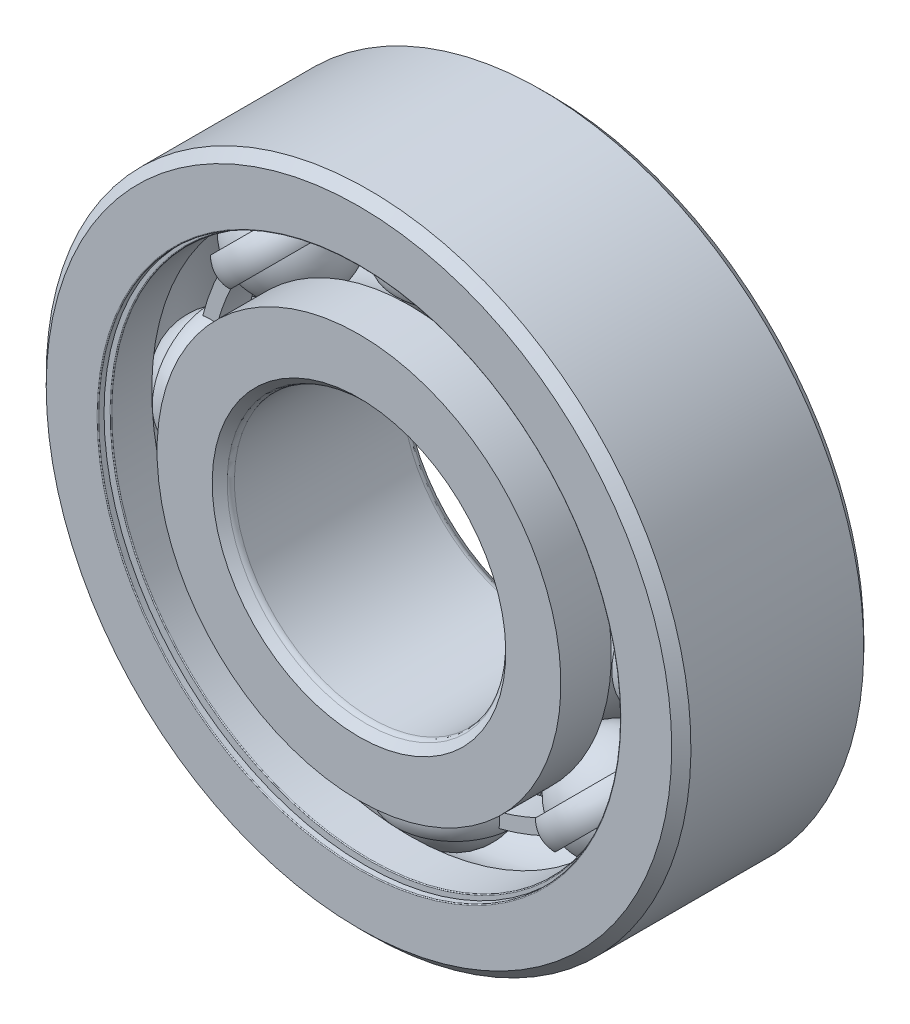
from build123d import *

# Parameters (mm, degrees)
BOSS_EXTRUDE1_DEPTH = 1.166666667
CIRPATTERN1_COUNT   = 8
CIRPATTERN2_COUNT   = 8
FILLET1_R           = 0.063
FILLET2_R           = 0.525


with BuildPart() as part:
    # Sketch3 → Revolve1 (revolve)
    with BuildSketch(Plane(origin=(0, 0, 0), x_dir=(0, 0, -1), z_dir=(1, 0, 0)), mode=Mode.PRIVATE) as revolve1_sk:
        with BuildLine():
            Line((6.3, 23.5), (7, 22.8))
            Line((7, 22.8), (7, 18.780769231))
            Line((7, 18.780769231), (3.325, 18.780769231))
            ThreePointArc((3.325, 18.780769231), (0, 20.646106861), (-3.325, 18.780769231))
            Line((-3.325, 18.780769231), (-7, 18.780769231))
            Line((-7, 18.780769231), (-7, 22.8))
            Line((-7, 22.8), (-6.3, 23.5))
            Line((-6.3, 23.5), (6.3, 23.5))
        make_face()
    revolve(revolve1_sk.sketch.rotate(Axis((0, 0, 7), (0, 0, -1)), 180), axis=Axis((0, 0, 7), (0, 0, -1)))

    # Sketch8 → Cut-Revolve1 (revolve, cut)
    with BuildSketch(Plane(origin=(0, 0, 0), x_dir=(0, 0, -1), z_dir=(1, 0, 0)), mode=Mode.PRIVATE) as cut_revolve1_sk:
        Polygon((-6.552, 18.780769231), (-6.3, 18.780769231), (-6.3, 20.353846154), (-6.552, 20.353846154), (-6.552, 19.032769231), (-7, 19.032769231), (-7, 18.780769231), align=None)
        Polygon((6.3, 18.780769231), (6.552, 18.780769231), (7, 18.780769231), (7, 19.032769231), (6.552, 19.032769231), (6.552, 20.353846154), (6.3, 20.353846154), align=None)
    revolve(cut_revolve1_sk.sketch.rotate(Axis((0, 0, 7), (0, 0, -1)), 180), axis=Axis((0, 0, 7), (0, 0, -1)), mode=Mode.SUBTRACT)

    # Fillet1
    fillet1_edges = [part.edges().sort_by_distance(p)[0] for p in [
        (0, 19.032769231, 7),
        (0, 18.780769231, 6.3),
        (0, 19.032769231, -7),
        (0, 18.780769231, -6.3),
    ]]
    fillet(fillet1_edges, radius=FILLET1_R)


with BuildPart() as body_2:
    # Sketch4 → Revolve2 (revolve)
    with BuildSketch(Plane(origin=(0, 0, 0), x_dir=(0, 0, -1), z_dir=(1, 0, 0)), mode=Mode.PRIVATE) as revolve2_sk:
        with BuildLine():
            Line((-6.3, 10), (-7, 10.7))
            Line((-7, 10.7), (-7, 14.719230769))
            Line((-7, 14.719230769), (-3.325, 14.719230769))
            ThreePointArc((-3.325, 14.719230769), (0, 12.853893139), (3.325, 14.719230769))
            Line((3.325, 14.719230769), (7, 14.719230769))
            Line((7, 14.719230769), (7, 10.7))
            Line((7, 10.7), (6.3, 10))
            Line((6.3, 10), (-6.3, 10))
        make_face()
    revolve(revolve2_sk.sketch.rotate(Axis((0, 0, 7), (0, 0, -1)), 180), axis=Axis((0, 0, 7), (0, 0, -1)))

    # Fillet2
    fillet2_edges = [body_2.edges().sort_by_distance(p)[0] for p in [
        (0, 10, 6.3),
        (0, 10, -6.3),
    ]]
    fillet(fillet2_edges, radius=FILLET2_R)


with BuildPart() as body_3:
    # Sketch5 → Revolve3 (revolve)
    with BuildSketch(Plane(origin=(0, 0, 0), x_dir=(0, 0, -1), z_dir=(1, 0, 0))):
        with BuildLine():
            Line((-3.896106861, 16.75), (3.896106861, 16.75))
            ThreePointArc((3.896106861, 16.75), (0, 20.646106861), (-3.896106861, 16.75))
        make_face()
    revolve(axis=Axis((0, 16.75, 3.896106861), (0, 0, -1)))


with BuildPart() as body_4:
    # Sketch6 → Revolve4 (revolve)
    with BuildSketch(Plane(origin=(0, 0, 0), x_dir=(0, 0, -1), z_dir=(1, 0, 0))):
        with BuildLine():
            Line((-3.761468164, 17.765384615), (-4.30122347, 17.765384615))
            ThreePointArc((-4.30122347, 17.765384615), (-4.571101123, 16.75), (-4.30122347, 15.734615385))
            Line((-4.30122347, 15.734615385), (-3.761468164, 15.734615385))
            ThreePointArc((-3.761468164, 15.734615385), (-3.896106861, 16.75), (-3.761468164, 17.765384615))
        make_face()
    revolve4 = revolve(axis=Axis((0, 23.5, 0), (0, -1, 0)))

    # Sketch7 → Boss-Extrude1 (add, symmetric)
    with BuildSketch(Plane.XY):
        with BuildLine():
            Line((12.348575073, 11.317031133), (13.09714541, 12.003069301))
            ThreePointArc((13.09714541, 12.003069301), (7.154360483, 16.261119783), (0, 17.765384615))
            Line((0, 17.765384615), (0, 16.75))
            ThreePointArc((0, 16.75), (6.745451375, 15.331711768), (12.348575073, 11.317031133))
        make_face()
    boss_extrude1 = extrude(amount=BOSS_EXTRUDE1_DEPTH, both=True)

    # CirPattern2: Revolve4, Boss-Extrude1 ×8 about axis
    cirpattern2_axis = Axis((0, 0, 0), (0, 0, 1))
    add([revolve4.rotate(cirpattern2_axis, i * 360 / CIRPATTERN2_COUNT) for i in range(1, CIRPATTERN2_COUNT)])
    add([boss_extrude1.rotate(cirpattern2_axis, i * 360 / CIRPATTERN2_COUNT) for i in range(1, CIRPATTERN2_COUNT)])


with BuildPart() as cirpattern1_1:
    # CirPattern1: pattern copy
    add(body_3.part.rotate(Axis((0, 0, 0), (0, 0, 1)), 1 * 360 / CIRPATTERN1_COUNT))


with BuildPart() as cirpattern1_2:
    # CirPattern1: pattern copy
    add(body_3.part.rotate(Axis((0, 0, 0), (0, 0, 1)), 2 * 360 / CIRPATTERN1_COUNT))


with BuildPart() as cirpattern1_3:
    # CirPattern1: pattern copy
    add(body_3.part.rotate(Axis((0, 0, 0), (0, 0, 1)), 3 * 360 / CIRPATTERN1_COUNT))


with BuildPart() as cirpattern1_4:
    # CirPattern1: pattern copy
    add(body_3.part.rotate(Axis((0, 0, 0), (0, 0, 1)), 4 * 360 / CIRPATTERN1_COUNT))


with BuildPart() as cirpattern1_5:
    # CirPattern1: pattern copy
    add(body_3.part.rotate(Axis((0, 0, 0), (0, 0, 1)), 5 * 360 / CIRPATTERN1_COUNT))


with BuildPart() as cirpattern1_6:
    # CirPattern1: pattern copy
    add(body_3.part.rotate(Axis((0, 0, 0), (0, 0, 1)), 6 * 360 / CIRPATTERN1_COUNT))


with BuildPart() as cirpattern1_7:
    # CirPattern1: pattern copy
    add(body_3.part.rotate(Axis((0, 0, 0), (0, 0, 1)), 7 * 360 / CIRPATTERN1_COUNT))


solid = Compound([part.part, body_2.part, body_3.part, body_4.part, cirpattern1_1.part, cirpattern1_2.part, cirpattern1_3.part, cirpattern1_4.part, cirpattern1_5.part, cirpattern1_6.part, cirpattern1_7.part])
